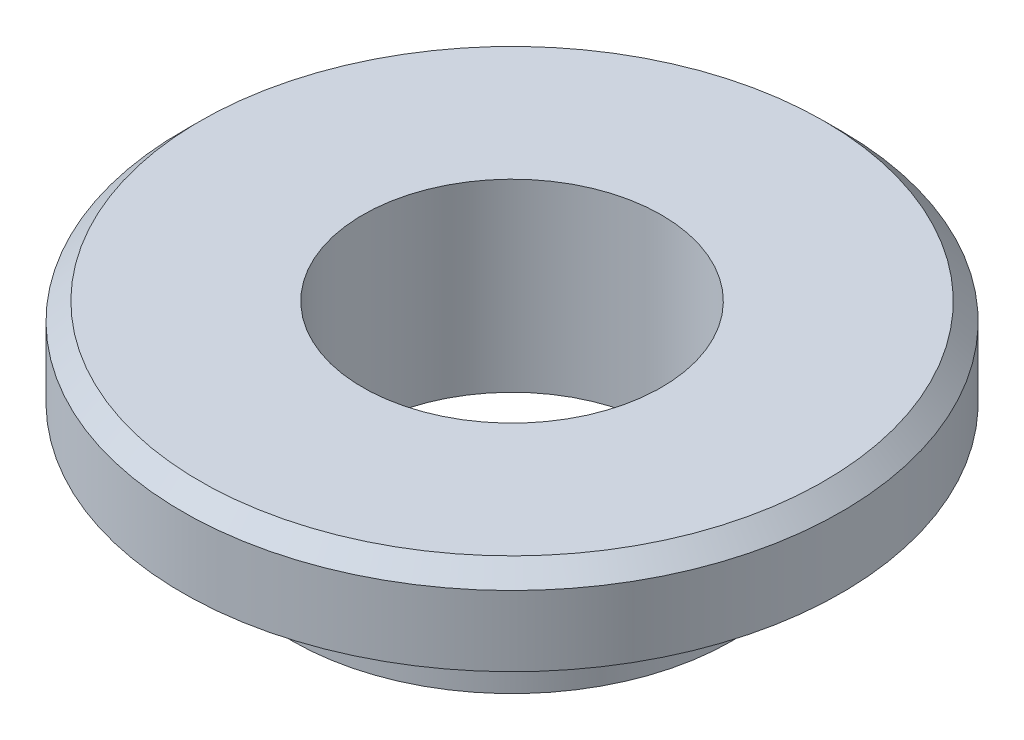
from build123d import *


with BuildPart() as part:
    # Washer Revolve Profile → Washer Revolve (revolve)
    with BuildSketch(Plane.XY):
        Polygon((2.159, 2.667), (2.159, 0), (3.175, 0), (3.175, 1.397), (4.7625, 1.397), (4.7625, 2.413), (4.5085, 2.667), align=None)
    revolve(axis=Axis((0, 0, 0), (0, 1, 0)))


solid = part.part
